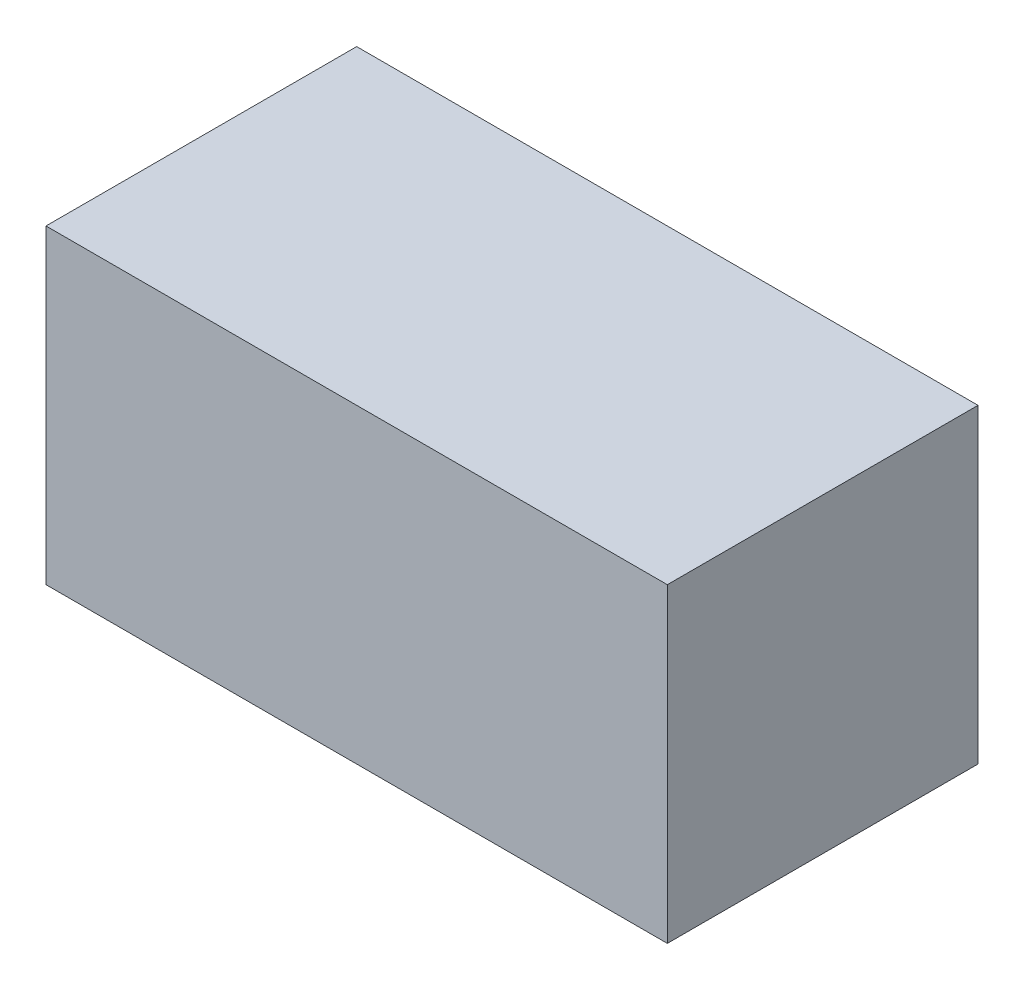
from build123d import *

# Parameters (mm, degrees)
SELECTIONSEED_W        = 20
SELECTIONSEED_H        = 10
SELECTIONEXTRUDE_DEPTH = 10


with BuildPart() as part:
    # SelectionSeed → SelectionExtrude (new body)
    with BuildSketch(Plane.XY):
        with Locations((30, 5)):
            Rectangle(SELECTIONSEED_W, SELECTIONSEED_H)
    extrude(amount=SELECTIONEXTRUDE_DEPTH)


solid = part.part
